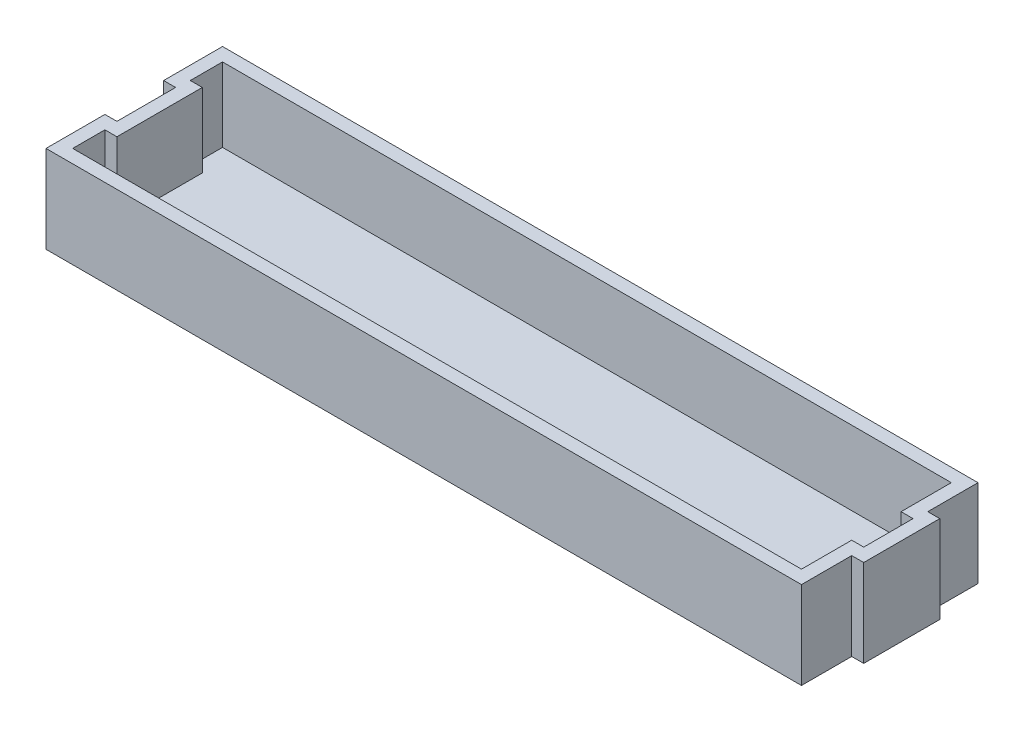
from build123d import *

# Parameters (mm, degrees)
BOSS_EXTRUDE1_DEPTH = 6.55
SHELL1_T            = -1


with BuildPart() as part:
    # Sketch1 → Boss-Extrude1 (new body)
    with BuildSketch(Plane(origin=(0, 0, 0), x_dir=(1, 0, 0), z_dir=(0, 1, 0))):
        Polygon((28.31, 6.615), (28.31, 2.85), (29.21, 2.85), (29.21, -2.85), (28.31, -2.85), (28.31, -6.615), (-28.31, -6.615), (-28.31, -2.2), (-27.41, -2.2), (-27.41, 2.2), (-28.31, 2.2), (-28.31, 6.615), align=None)
    extrude(amount=BOSS_EXTRUDE1_DEPTH)

    # Shell1
    shell1_openings = [part.faces().sort_by_distance(p)[0] for p in [
        (0.343703441, 6.55, 0),
    ]]
    offset(amount=SHELL1_T, openings=shell1_openings, kind=Kind.INTERSECTION)


solid = part.part
